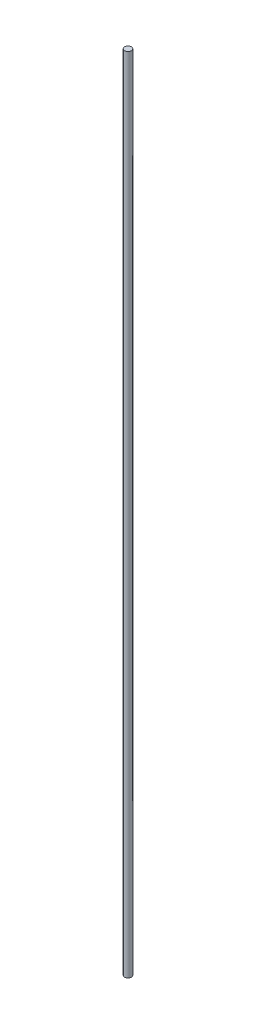
from build123d import *

# Parameters (mm, degrees)
SKETCH1_R           = 6.35
BOSS_EXTRUDE1_DEPTH = 1497.33


with BuildPart() as part:
    # Sketch1 → Boss-Extrude1 (new body)
    with BuildSketch(Plane(origin=(0, 0, 0), x_dir=(-1, 0, 0), z_dir=(0, 1, 0))):
        Circle(SKETCH1_R)
    extrude(amount=BOSS_EXTRUDE1_DEPTH)


solid = part.part
